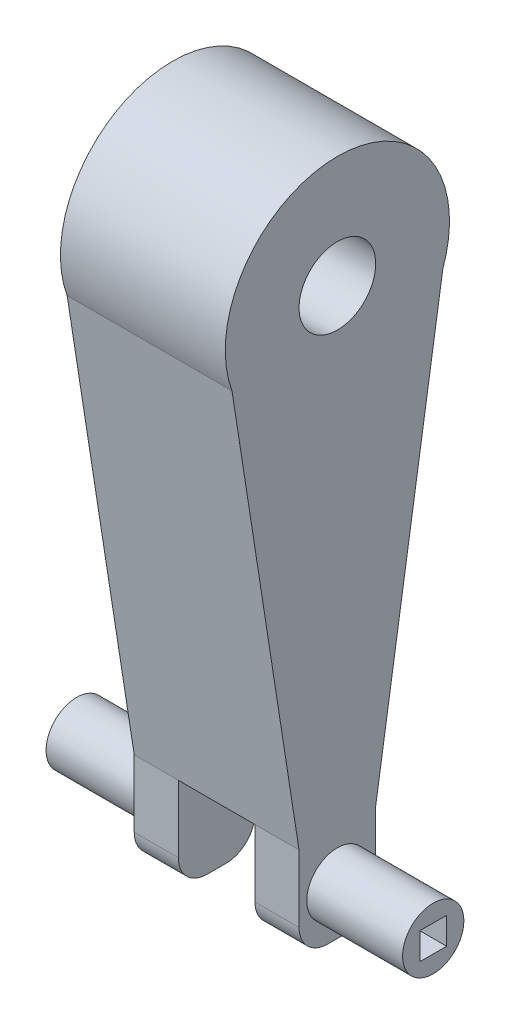
from build123d import *

# Parameters (mm, degrees)
ESQUISSE1_R             = 100
ESQUISSE1_R_2           = 80
BOSS_EXTRU_1_DEPTH      = 430
ESQUISSE1_3_R           = 80
BOSS_EXTRU_2_DEPTH      = 250
ESQUISSE1_5_R           = 80
BOSS_EXTRU_3_DEPTH      = 680
ESQUISSE2_W             = 200
ESQUISSE2_H             = 250
ENL_V_MAT_EXTRU_2_DEPTH = 680
ESQUISSE3_W             = 70
ESQUISSE3_H             = 70
ENL_V_MAT_EXTRU_3_DEPTH = 100
ESQUISSE4_W             = 70
ESQUISSE4_H             = 70
ENL_V_MAT_EXTRU_4_DEPTH = 100


with BuildPart() as part:
    # Esquisse1 → Boss.-Extru.1 (new body)
    with BuildSketch(Plane(origin=(0, 0, 0), x_dir=(0, 0, -1), z_dir=(1, 0, 0))):
        with BuildLine():
            Line((-275, -99.65565714), (-100, -1224.65565714))
            Line((-100, -1224.65565714), (-100, -1399.65565714))
            ThreePointArc((-100, -1399.65565714), (-78.033008589, -1452.688665729), (-25, -1474.65565714))
            Line((-25, -1474.65565714), (25, -1474.65565714))
            ThreePointArc((25, -1474.65565714), (78.033008589, -1452.688665729), (100, -1399.65565714))
            Line((100, -1399.65565714), (100, -1224.65565714))
            Line((100, -1224.65565714), (275, -99.65565714))
            ThreePointArc((275, -99.65565714), (0, 292.5), (-275, -99.65565714))
        make_face()
        Circle(ESQUISSE1_R, mode=Mode.SUBTRACT)
        with Locations((0, -1349.65565714)):
            Circle(ESQUISSE1_R_2, mode=Mode.SUBTRACT)
    extrude(amount=BOSS_EXTRU_1_DEPTH)



with BuildPart() as body_2:
    # Esquisse1<3> → Boss.-Extru.2 (new body)
    with BuildSketch(Plane(origin=(0, 0, 0), x_dir=(0, 0, -1), z_dir=(1, 0, 0))):
        with Locations((0, -1349.65565714)):
            Circle(ESQUISSE1_3_R)
    extrude(amount=-BOSS_EXTRU_2_DEPTH)


with BuildPart() as part_1:
    add(part.part)

    add(body_2.part)  # Boss.-Extru.3 merges body 2
    # Esquisse1<5> → Boss.-Extru.3 (add)
    with BuildSketch(Plane(origin=(0, 0, 0), x_dir=(0, 0, -1), z_dir=(1, 0, 0))):
        with Locations((0, -1349.65565714)):
            Circle(ESQUISSE1_5_R)
    extrude(amount=BOSS_EXTRU_3_DEPTH)

    # Esquisse2 → Enlèv. mat.-Extru.2 (cut)
    with BuildSketch(Plane.XY.offset(100)):
        with Locations((215, -1349.65565714)):
            Rectangle(ESQUISSE2_W, ESQUISSE2_H)
    extrude(amount=-ENL_V_MAT_EXTRU_2_DEPTH, mode=Mode.SUBTRACT)

    # Esquisse3 → Enlèv. mat.-Extru.3 (cut)
    with BuildSketch(Plane.ZY.offset(250)):
        with Locations((0, -1349.65565714)):
            Rectangle(ESQUISSE3_W, ESQUISSE3_H)
    extrude(amount=-ENL_V_MAT_EXTRU_3_DEPTH, mode=Mode.SUBTRACT)

    # Esquisse4 → Enlèv. mat.-Extru.4 (cut)
    with BuildSketch(Plane(origin=(680, 0, 0), x_dir=(0, 0, -1), z_dir=(1, 0, 0))):
        with Locations((0, -1349.65565714)):
            Rectangle(ESQUISSE4_W, ESQUISSE4_H)
    extrude(amount=-ENL_V_MAT_EXTRU_4_DEPTH, mode=Mode.SUBTRACT)


solid = part_1.part
